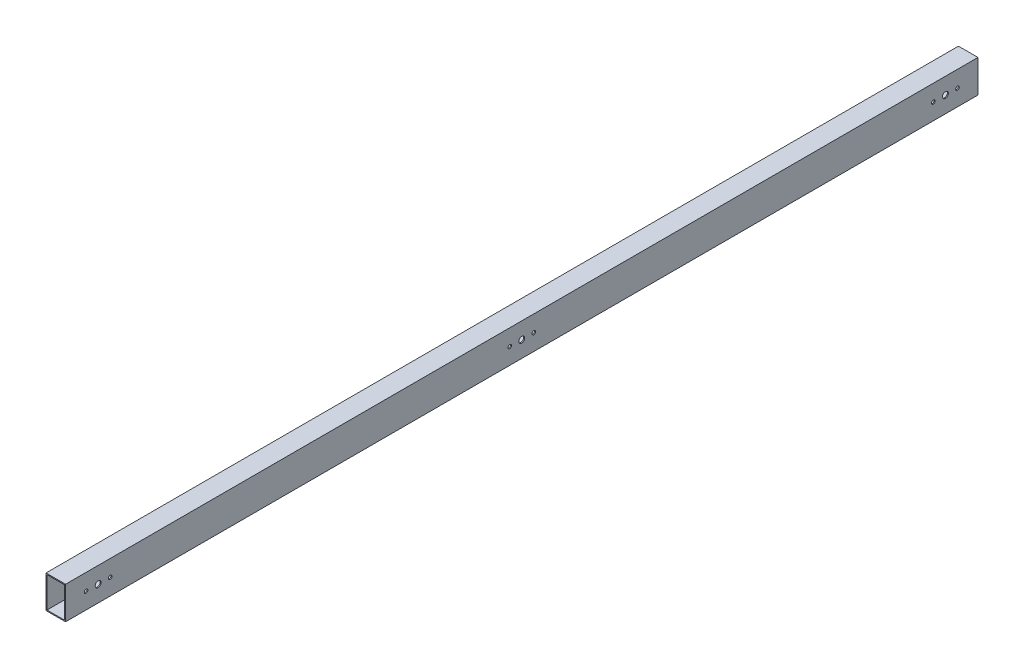
from build123d import *

# Parameters (mm, degrees)
ESBO_O1_W                   = 30
ESBO_O1_H                   = 50
ESBO_O1_W_2                 = 27
ESBO_O1_H_2                 = 47
RESSALTO_EXTRUS_O1_DEPTH    = 1400
FURO_COM_FOLGA_DE_M52_D     = 5.5
FURO_COM_FOLGA_DE_M81_D     = 9
FURO_COM_FOLGA_DE_M84_D     = 9
FURO_COM_FOLGA_DE_M84_DEPTH = 1.5


with BuildPart() as part:
    # Esboço1 → Ressalto-extrusão1 (new body)
    with BuildSketch(Plane.XY):
        with Locations((15, 25)):
            Rectangle(ESBO_O1_W, ESBO_O1_H)
        with Locations((15, 25)):
            Rectangle(ESBO_O1_W_2, ESBO_O1_H_2, mode=Mode.SUBTRACT)
    extrude(amount=RESSALTO_EXTRUS_O1_DEPTH)

    # Furo com folga de M52 (through all)
    with Locations(Plane(origin=(30, 0, 0), x_dir=(0, 0, -1), z_dir=(1, 0, 0))):
        with Locations((-1368.5, 25), (-1331.5, 25), (-68.5, 25), (-31.5, 25), (-718.5, 25), (-681.5, 25)):
            Hole(FURO_COM_FOLGA_DE_M52_D / 2)

    # Furo com folga de M81 (through all)
    with Locations(Plane(origin=(30, 0, 0), x_dir=(0, 0, -1), z_dir=(1, 0, 0))):
        with Locations((-1350, 25), (-50, 25)):
            Hole(FURO_COM_FOLGA_DE_M81_D / 2)

    # Furo com folga de M84
    with Locations(Plane(origin=(30, 0, 0), x_dir=(0, 0, -1), z_dir=(1, 0, 0))):
        with Locations((-700, 25)):
            Hole(FURO_COM_FOLGA_DE_M84_D / 2, depth=FURO_COM_FOLGA_DE_M84_DEPTH)


solid = part.part
